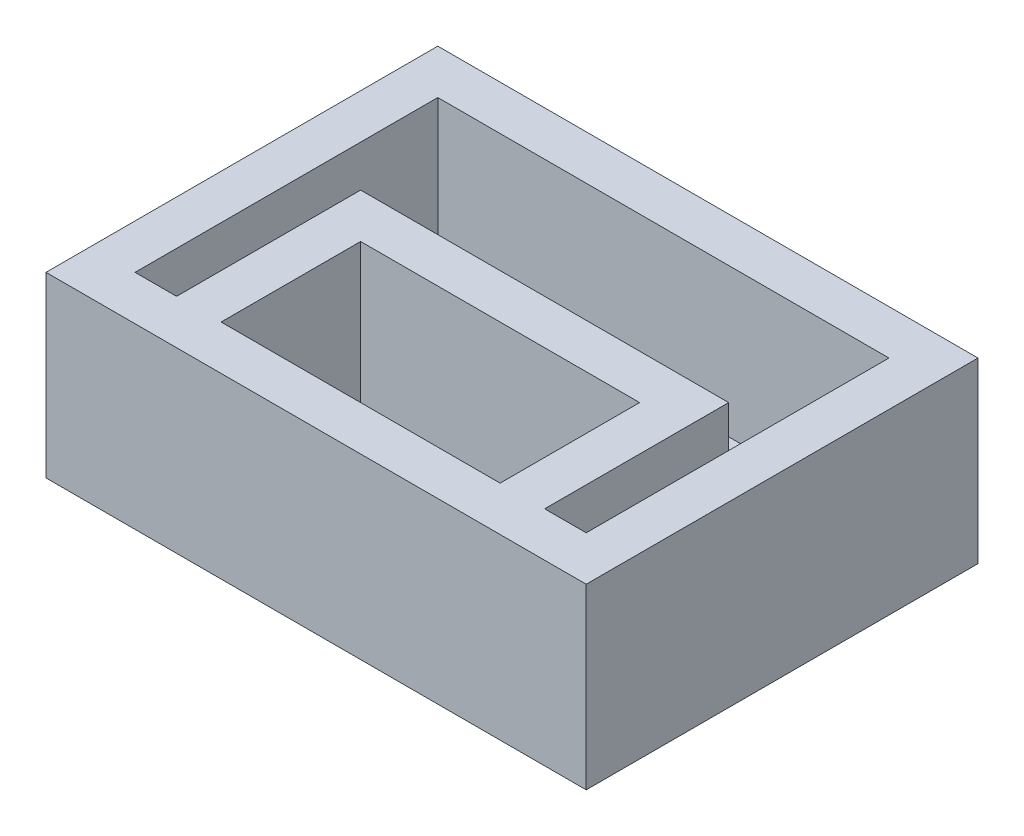
from build123d import *

# Parameters (mm, degrees)
SKETCH_1_W      = 18.2
SKETCH_1_H      = 13.2
SKETCH_1_W_2    = 9.4
SKETCH_1_H_2    = 4.7
EXTRUDE_1_DEPTH = 5
SKETCH_6_W      = 18.2
SKETCH_6_H      = 13.2
EXTRUDE_4_DEPTH = 1
SKETCH_7_W      = 1.4
SKETCH_7_H      = 10.2
EXTRUDE_5_DEPTH = 1


with BuildPart() as part:
    # Эскиз1 → Бобышка-Вытянуть1 (new body)
    with BuildSketch(Plane(origin=(0, 0, 0), x_dir=(1, 0, 0), z_dir=(0, 1, 0))):
        Rectangle(SKETCH_1_W, SKETCH_1_H)
        Polygon((-6.2, -5.1), (-6.2, 1.1), (6.2, 1.1), (6.2, -5.1), (7.6, -5.1), (7.6, 5.1), (-7.6, 5.1), (-7.6, -5.1), align=None, mode=Mode.SUBTRACT)
        with Locations((0, -2.75)):
            Rectangle(SKETCH_1_W_2, SKETCH_1_H_2, mode=Mode.SUBTRACT)
    extrude(amount=EXTRUDE_1_DEPTH)

    # Эскиз6 → Бобышка-Вытянуть4 (add)
    with BuildSketch(Plane.XZ):
        Rectangle(SKETCH_6_W, SKETCH_6_H)
    extrude(amount=EXTRUDE_4_DEPTH)

    # Эскиз7 → Бобышка-Вытянуть5 (add)
    with BuildSketch(Plane(origin=(0, 0, 0), x_dir=(1, 0, 0), z_dir=(0, 1, 0))):
        with Locations((-6.9, 0)):
            Rectangle(SKETCH_7_W, SKETCH_7_H)
        with Locations((6.9, 0)):
            Rectangle(SKETCH_7_W, SKETCH_7_H)
    extrude(amount=EXTRUDE_5_DEPTH)


solid = part.part
